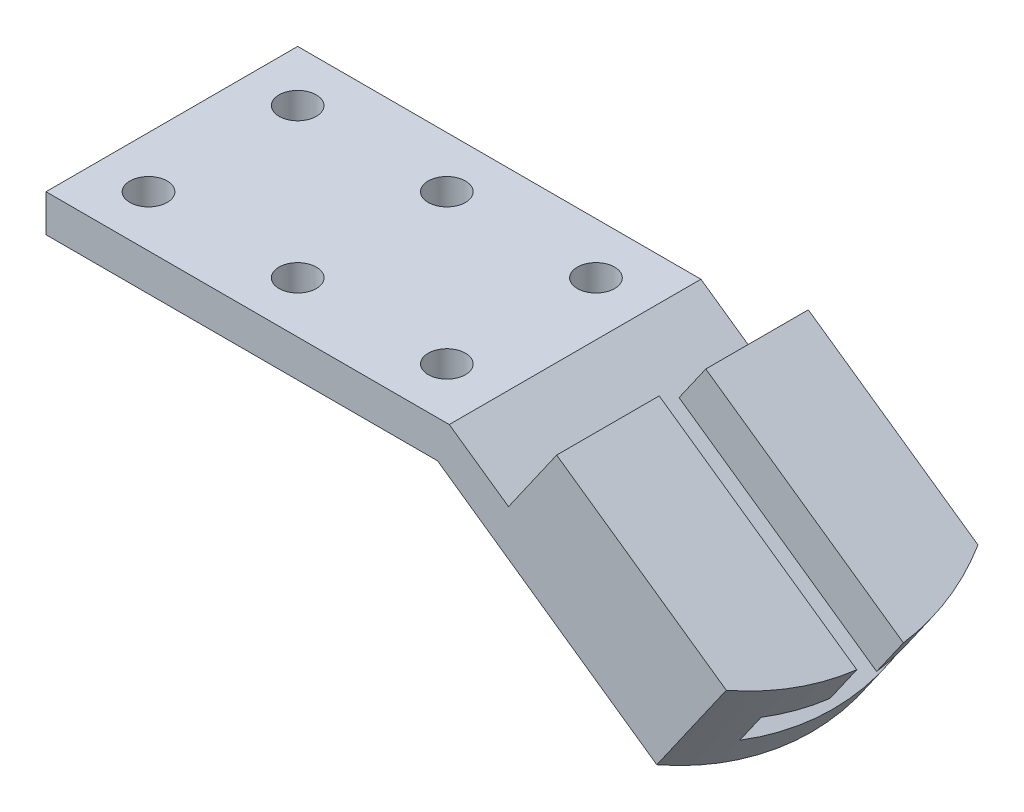
from build123d import *

# Parameters (mm, degrees)
BOSS_EXTRUDE1_DEPTH = 27
CUT_EXTRUDE1_REACH  = 163.033
SKETCH2_R           = 4
CUT_EXTRUDE2_REACH  = 146.741
CUT_EXTRUDE3_START  = -26
CUT_EXTRUDE3_DEPTH  = 26


with BuildPart() as part:
    # Sketch1 → Boss-Extrude1 (new, symmetric)
    with BuildSketch(Plane.XY):
        Polygon((0, 0), (84, 0), (137.244882879, -37.282468363), (152.157870224, -15.984515211), (109.561963921, 13.841459479), (99.237588067, -0.903277318), (86.522390311, 8), (0, 8), align=None)
    extrude(amount=BOSS_EXTRUDE1_DEPTH, both=True)

    # Sketch2 → Cut-Extrude1 (cut, up to next)
    with BuildSketch(Plane(origin=(0, 8, 0), x_dir=(1, 0, 0), z_dir=(0, 1, 0)), mode=Mode.PRIVATE) as cut_extrude1_sk1:
        with Locations(Location((11, 16, 0), (0, 0, 180))):
            Circle(SKETCH2_R)
    cut_extrude1_tool1 = extrude(cut_extrude1_sk1.sketch, amount=-CUT_EXTRUDE1_REACH, mode=Mode.PRIVATE) & part.part
    # Sketch2 → Cut-Extrude1 (cut, up to next)
    with BuildSketch(Plane(origin=(0, 8, 0), x_dir=(1, 0, 0), z_dir=(0, 1, 0)), mode=Mode.PRIVATE) as cut_extrude1_sk2:
        with Locations(Location((43, 16, 0), (0, 0, 180))):
            Circle(SKETCH2_R)
    cut_extrude1_tool2 = extrude(cut_extrude1_sk2.sketch, amount=-CUT_EXTRUDE1_REACH, mode=Mode.PRIVATE) & part.part
    # Sketch2 → Cut-Extrude1 (cut, up to next)
    with BuildSketch(Plane(origin=(0, 8, 0), x_dir=(1, 0, 0), z_dir=(0, 1, 0)), mode=Mode.PRIVATE) as cut_extrude1_sk3:
        with Locations(Location((75, 16, 0), (0, 0, 180))):
            Circle(SKETCH2_R)
    cut_extrude1_tool3 = extrude(cut_extrude1_sk3.sketch, amount=-CUT_EXTRUDE1_REACH, mode=Mode.PRIVATE) & part.part
    # Sketch2 → Cut-Extrude1 (cut, up to next)
    with BuildSketch(Plane(origin=(0, 8, 0), x_dir=(1, 0, 0), z_dir=(0, 1, 0)), mode=Mode.PRIVATE) as cut_extrude1_sk4:
        with Locations(Location((43, -16, 0), (0, 0, 180))):
            Circle(SKETCH2_R)
    cut_extrude1_tool4 = extrude(cut_extrude1_sk4.sketch, amount=-CUT_EXTRUDE1_REACH, mode=Mode.PRIVATE) & part.part
    # Sketch2 → Cut-Extrude1 (cut, up to next)
    with BuildSketch(Plane(origin=(0, 8, 0), x_dir=(1, 0, 0), z_dir=(0, 1, 0)), mode=Mode.PRIVATE) as cut_extrude1_sk5:
        with Locations(Location((75, -16, 0), (0, 0, 180))):
            Circle(SKETCH2_R)
    cut_extrude1_tool5 = extrude(cut_extrude1_sk5.sketch, amount=-CUT_EXTRUDE1_REACH, mode=Mode.PRIVATE) & part.part
    # Sketch2 → Cut-Extrude1 (cut, up to next)
    with BuildSketch(Plane(origin=(0, 8, 0), x_dir=(1, 0, 0), z_dir=(0, 1, 0)), mode=Mode.PRIVATE) as cut_extrude1_sk6:
        with Locations(Location((11, -16, 0), (0, 0, 180))):
            Circle(SKETCH2_R)
    cut_extrude1_tool6 = extrude(cut_extrude1_sk6.sketch, amount=-CUT_EXTRUDE1_REACH, mode=Mode.PRIVATE) & part.part
    add(cut_extrude1_tool1.solids().sort_by_distance((11, 8, -16))[0], mode=Mode.SUBTRACT)
    add(cut_extrude1_tool2.solids().sort_by_distance((43, 8, -16))[0], mode=Mode.SUBTRACT)
    add(cut_extrude1_tool3.solids().sort_by_distance((75, 8, -16))[0], mode=Mode.SUBTRACT)
    add(cut_extrude1_tool4.solids().sort_by_distance((43, 8, 16))[0], mode=Mode.SUBTRACT)
    add(cut_extrude1_tool5.solids().sort_by_distance((75, 8, 16))[0], mode=Mode.SUBTRACT)
    add(cut_extrude1_tool6.solids().sort_by_distance((11, 8, 16))[0], mode=Mode.SUBTRACT)

    # Sketch3 → Cut-Extrude2 (cut, up to next)
    with BuildSketch(Plane(origin=(109.609728898, -76.749558436, 0), x_dir=(0, 0, -1), z_dir=(0.819152044288994, -0.5735764363510429, 0)), mode=Mode.PRIVATE) as cut_extrude2_sk1:
        Polygon((-5, 74.180420653), (5, 74.180420653), (5, 64.180420653), (17.5, 64.180420653), (17.5, 56.180420653), (-17.5, 56.180420653), (-17.5, 64.180420653), (-5, 64.180420653), align=None)
    cut_extrude2_tool1 = extrude(cut_extrude2_sk1.sketch, amount=-CUT_EXTRUDE2_REACH, mode=Mode.PRIVATE) & part.part
    add(cut_extrude2_tool1.solids().sort_by_distance((145.486271, -25.512547, 0))[0], mode=Mode.SUBTRACT)

    # Sketch5 → Cut-Extrude3 (cut)
    with BuildSketch(Plane(origin=(42.548141325, 60.765043225, 0), x_dir=(0.8191520442889936, -0.5735764363510437, 0), z_dir=(0.5735764363510436, 0.8191520442889935, 0)).offset(CUT_EXTRUDE3_START)):
        with BuildLine():
            Line((126.249743807, 27), (150.866337787, 27))
            Line((150.866337787, 27), (150.866337787, -27))
            Line((150.866337787, -27), (126.249743807, -27))
            ThreePointArc((126.249743807, -27), (133.80877172, 0), (126.249743807, 27))
        make_face()
    extrude(amount=CUT_EXTRUDE3_DEPTH, mode=Mode.SUBTRACT)


solid = part.part
